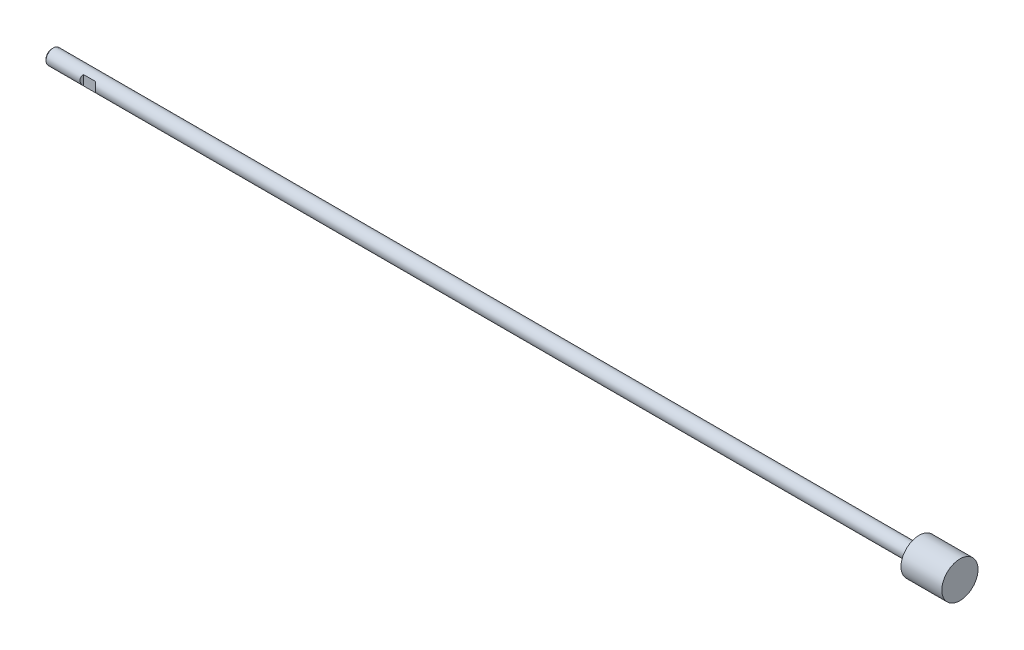
from build123d import *

# Parameters (mm, degrees)
CUT_EXTRUDE_1_DEPTH      = 3
CUT_EXTRUDE_1_DEPTH_BACK = 3


with BuildPart() as part:
    # 草图1 → 旋转1 (revolve)
    with BuildSketch(Plane.XY):
        Polygon((0, 0), (0, 3.233), (0.767, 4), (467, 4), (467, 9.75), (489, 9.75), (489, 0), align=None)
    revolve(axis=Axis((489, 0, 0), (-1, 0, 0)))

    # 草图2 → 切除-拉伸1 (cut, two sides: drawn at the far end of the back side and taken through both)
    with BuildSketch(Plane(origin=(0, 0, 0), x_dir=(1, 0, 0), z_dir=(0, 1, 0)).offset(-CUT_EXTRUDE_1_DEPTH_BACK)):
        Polygon((-5, -12), (35.4, -12), (26.4, -3), (20, -3), (18, -5), (18, -10), (-3, -10), (-3, 10), (18, 10), (18, 5), (20, 3), (26.4, 3), (35.4, 12), (-5, 12), align=None)
    extrude(amount=CUT_EXTRUDE_1_DEPTH + CUT_EXTRUDE_1_DEPTH_BACK, mode=Mode.SUBTRACT)


solid = part.part
